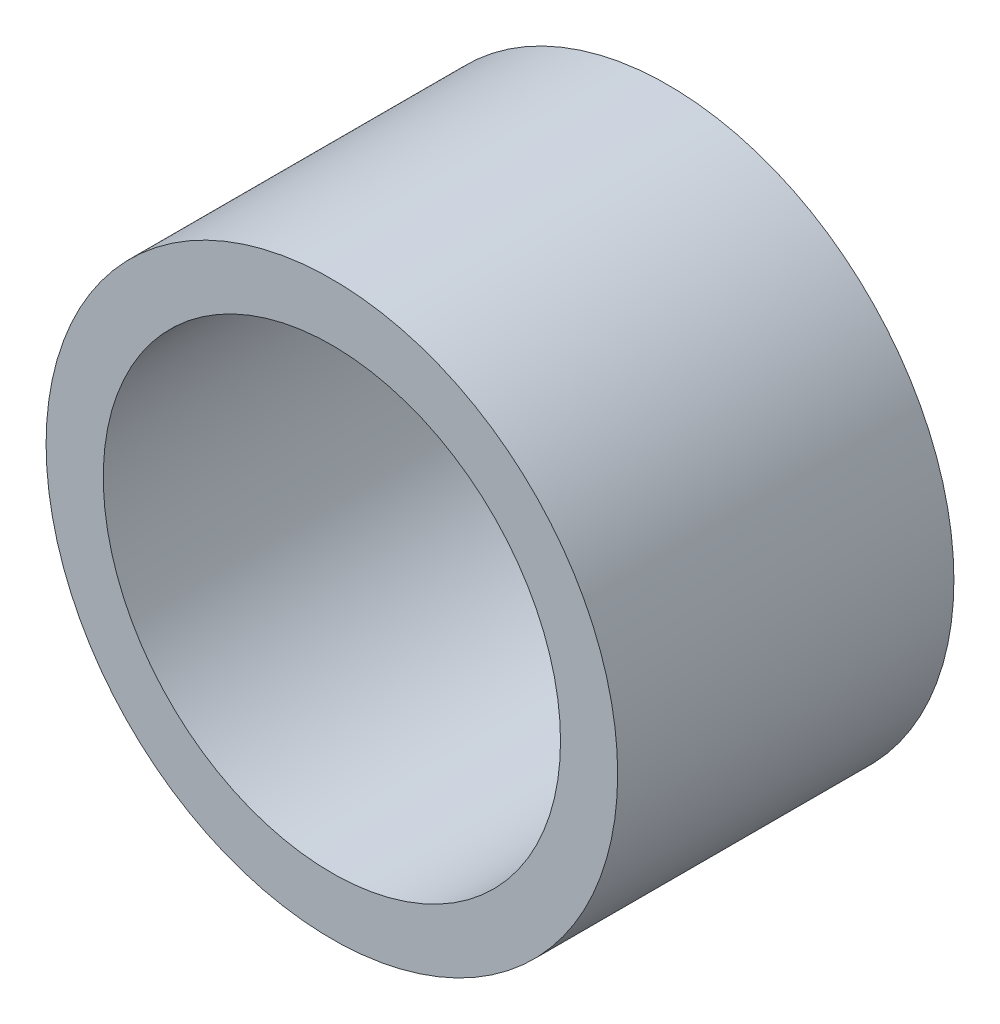
from build123d import *

# Parameters (mm, degrees)
SKETCH1_R           = 4.25
SKETCH1_R_2         = 3.4
BOSS_EXTRUDE1_DEPTH = 5


with BuildPart() as part:
    # Sketch1 → Boss-Extrude1 (new body)
    with BuildSketch(Plane.XY):
        Circle(SKETCH1_R)
        Circle(SKETCH1_R_2, mode=Mode.SUBTRACT)
    extrude(amount=BOSS_EXTRUDE1_DEPTH)


solid = part.part
